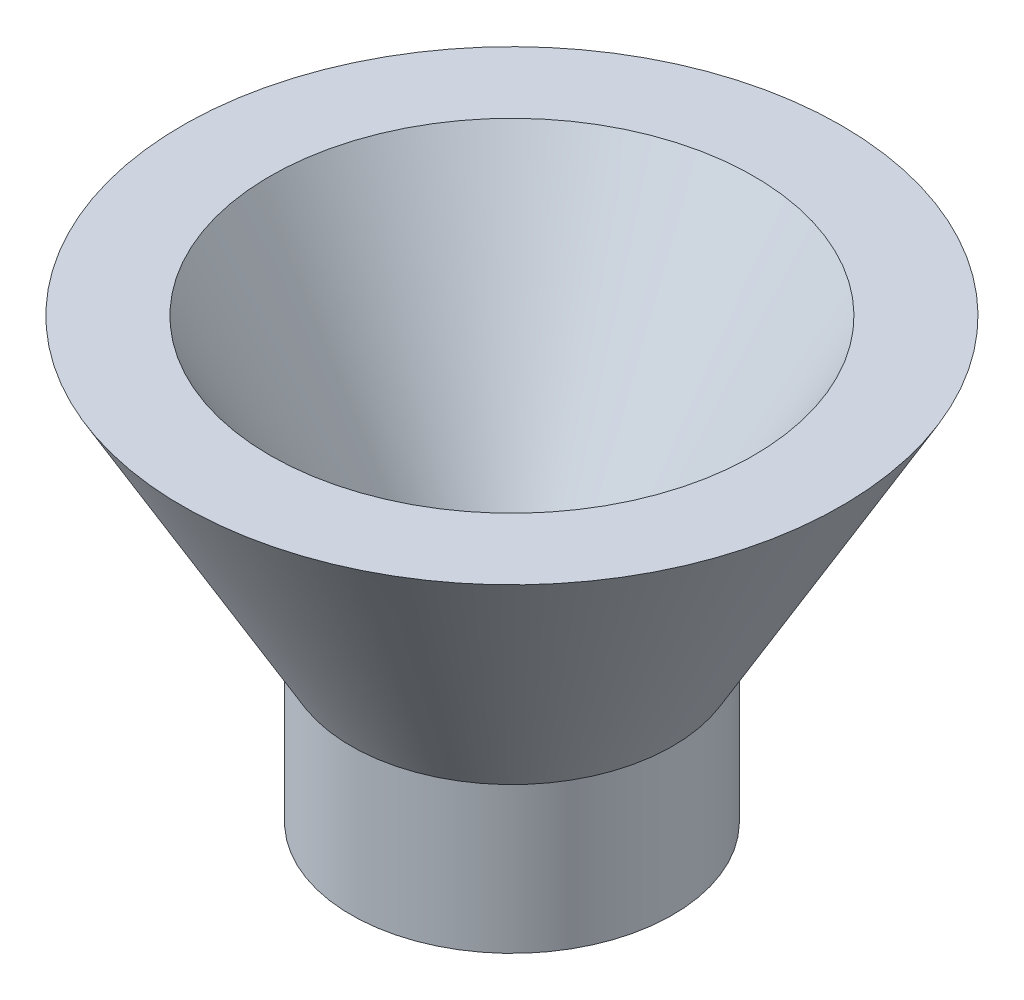
from build123d import *


with BuildPart() as part:
    # Esquisse1 → Révolution1 (revolve)
    with BuildSketch(Plane.XY, mode=Mode.PRIVATE) as r_volution1_sk:
        Polygon((2.5, 0), (2.5, 5), (8.273502692, 15), (11.273502692, 15), (5.5, 5), (5.5, 0), align=None)
    revolve(r_volution1_sk.sketch.rotate(Axis((0, 0, 0), (0, 1, 0)), 90), axis=Axis((0, 0, 0), (0, 1, 0)))


solid = part.part
